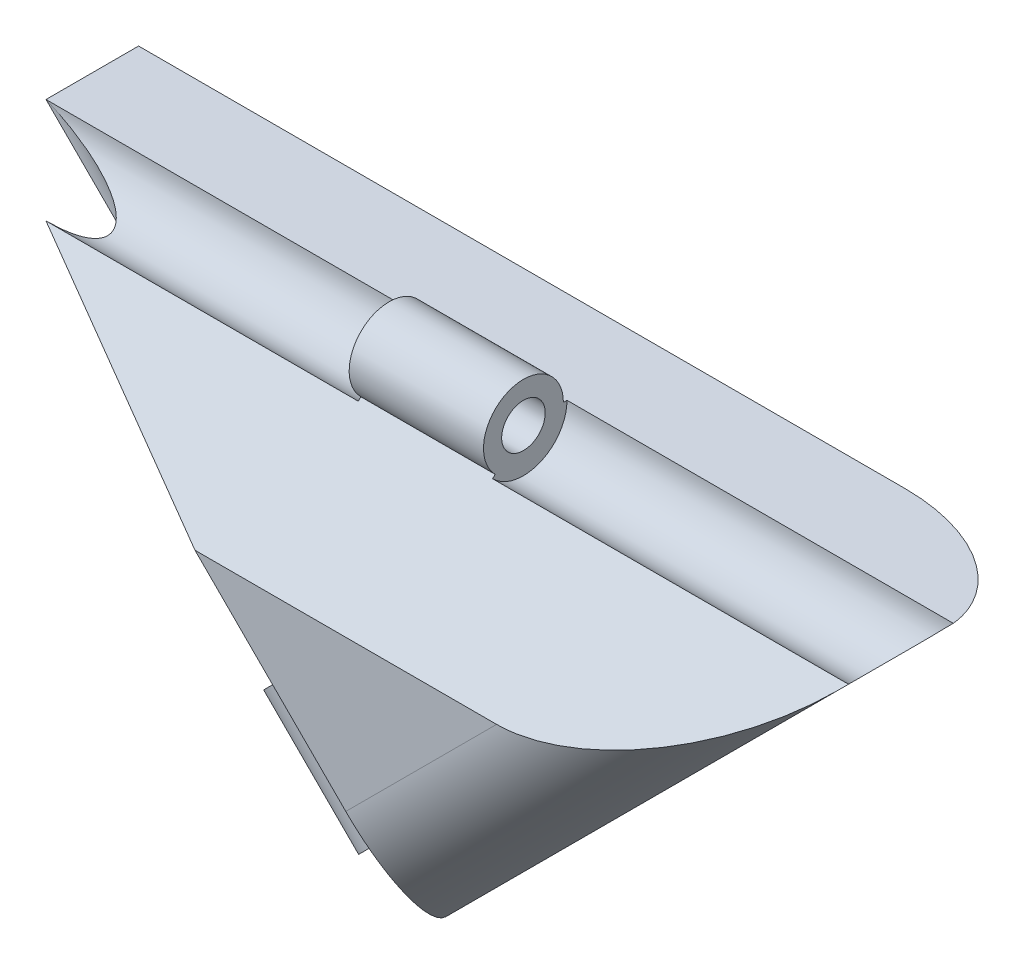
from build123d import *

# Parameters (mm, degrees)
BOSS_EXTRUDE1_DEPTH      = 15
CUT_EXTRUDE1_DEPTH       = 34.582402799
CUT_EXTRUDE1_DEPTH_BACK  = 34.582402799
BOSS_EXTRUDE2_DEPTH      = 3.7
BOSS_EXTRUDE2_DEPTH_BACK = 3.7
SKETCH2_5_R              = 1.2
CUT_EXTRUDE2_DEPTH       = 42.134683932
BOSS_EXTRUDE3_START      = -3.8
SKETCH4_3_R              = 1.2
BOSS_EXTRUDE3_DEPTH      = 7.4
FILLET1_R                = 5.5
FILLET2_R                = 5.5


with BuildPart() as part:
    # Sketch1 → Boss-Extrude1 (new body)
    with BuildSketch(Plane(origin=(0, 0, 0), x_dir=(0, 1, 0), z_dir=(0, 0, 1))):
        Polygon((8.333333333, 25), (8.333333333, -25), (-16.666666667, 0), align=None)
    extrude(amount=BOSS_EXTRUDE1_DEPTH)

    # Sketch2 → Cut-Extrude1 (cut, two sides: drawn at the far end of the back side and taken through both)
    with BuildSketch(Plane.YZ.offset(-CUT_EXTRUDE1_DEPTH_BACK)):
        with BuildLine():
            Line((8.333333333, 15), (0.833333333, 15))
            Line((0.833333333, 15), (6.636277058, 9.197056275))
            ThreePointArc((6.636277058, 9.197056275), (9.251773571, 5.282689122), (8.333333333, 9.9))
            Line((8.333333333, 9.9), (8.333333333, 15))
        make_face()
    extrude(amount=CUT_EXTRUDE1_DEPTH + CUT_EXTRUDE1_DEPTH_BACK, mode=Mode.SUBTRACT)

    # Sketch2<5> → Boss-Extrude2 (add, two sides: drawn at the far end of the back side and taken through both)
    with BuildSketch(Plane.YZ.offset(-BOSS_EXTRUDE2_DEPTH_BACK)):
        with BuildLine():
            Line((6.777698415, 9.055634919), (6.636277058, 9.197056275))
            ThreePointArc((6.636277058, 9.197056275), (6.116022455, 6.581559762), (8.333333333, 5.1))
            Line((8.333333333, 5.1), (8.333333333, 5.3))
            ThreePointArc((8.333333333, 5.3), (10.365868305, 8.341903551), (6.777698415, 9.055634919))
        make_face()
        with Locations((8.333333333, 7.5)):
            Circle(SKETCH2_5_R, mode=Mode.SUBTRACT)
    extrude(amount=BOSS_EXTRUDE2_DEPTH + BOSS_EXTRUDE2_DEPTH_BACK)

    # Sketch4 → Cut-Extrude2 (cut, through all)
    with BuildSketch(Plane(origin=(8.333333333, -8.333333333, 0), x_dir=(0.7071067811865486, 0.7071067811865465, 0), z_dir=(0.7071067811865465, -0.7071067811865486, 0))):
        with BuildLine():
            ThreePointArc((-11.78511302, 9.9), (-12.703553257, 5.282689122), (-10.088056745, 9.197056275))
            Line((-10.088056745, 9.197056275), (-4.28511302, 15))
            Line((-4.28511302, 15), (-11.78511302, 15))
            Line((-11.78511302, 15), (-11.78511302, 9.9))
        make_face()
    extrude(amount=-CUT_EXTRUDE2_DEPTH, mode=Mode.SUBTRACT)

    # Sketch4<3> → Boss-Extrude3 (add)
    with BuildSketch(Plane(origin=(8.333333333, -8.333333333, 0), x_dir=(0.7071067811865486, 0.7071067811865465, 0), z_dir=(0.7071067811865465, -0.7071067811865486, 0)).offset(BOSS_EXTRUDE3_START)):
        with BuildLine():
            ThreePointArc((-10.229478101, 9.055634919), (-13.817647991, 8.341903551), (-11.78511302, 5.3))
            Line((-11.78511302, 5.3), (-11.78511302, 5.1))
            ThreePointArc((-11.78511302, 5.1), (-9.567802142, 6.581559762), (-10.088056745, 9.197056275))
            Line((-10.088056745, 9.197056275), (-10.229478101, 9.055634919))
        make_face()
        with Locations((-11.78511302, 7.5)):
            Circle(SKETCH4_3_R, mode=Mode.SUBTRACT)
    extrude(amount=-BOSS_EXTRUDE3_DEPTH)

    # Fillet1
    fillet1_edges = [part.edges().sort_by_distance(p)[0] for p in [
        (12.5, -4.166666667, 0),
    ]]
    fillet(fillet1_edges, radius=FILLET1_R)

    # Fillet2
    fillet2_edges = [part.edges().sort_by_distance(p)[0] for p in [
        (11.401650429, -5.265016237, 15),
    ]]
    fillet(fillet2_edges, radius=FILLET2_R)


solid = part.part
